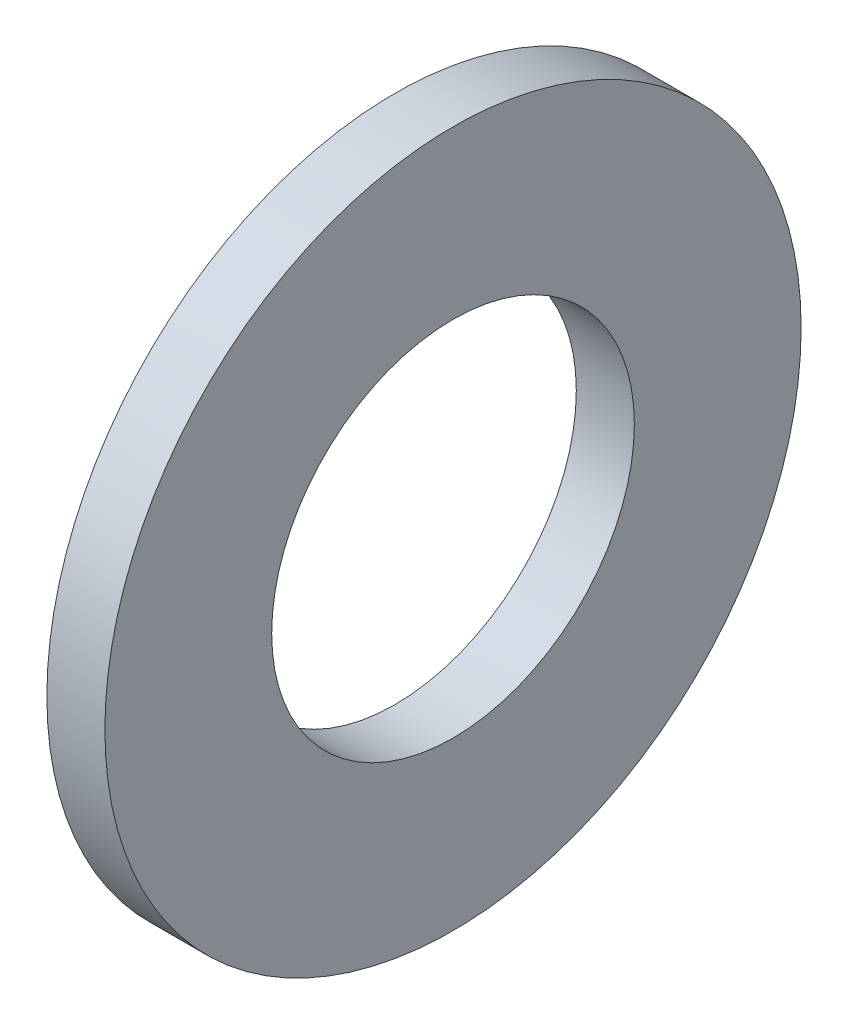
from build123d import *

# Parameters (mm, degrees)
SKETCH1_R           = 6
SKETCH1_R_2         = 3.125
BOSS_EXTRUDE1_DEPTH = 0.5


with BuildPart() as part:
    # Sketch1 → Boss-Extrude1 (new, symmetric)
    with BuildSketch(Plane(origin=(0, 0, 0), x_dir=(0, 0, -1), z_dir=(1, 0, 0))):
        Circle(SKETCH1_R)
        Circle(SKETCH1_R_2, mode=Mode.SUBTRACT)
    extrude(amount=BOSS_EXTRUDE1_DEPTH, both=True)


solid = part.part
